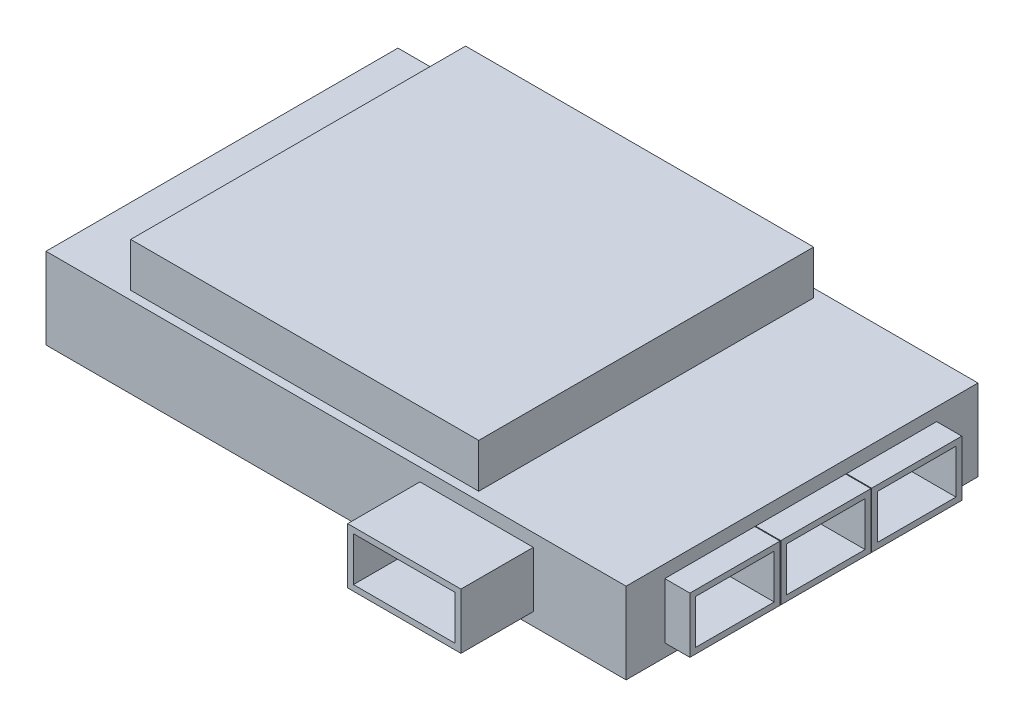
from build123d import *

# Parameters (mm, degrees)
SKETCH1_W           = 38.1
SKETCH1_H           = 23.114
BOSS_EXTRUDE1_DEPTH = 5.334
SKETCH2_W           = 22.86
SKETCH2_H           = 21.9964
BOSS_EXTRUDE2_DEPTH = 2.8956
SKETCH3_W           = 7.4422
SKETCH3_H           = 3.6576
BOSS_EXTRUDE3_DEPTH = 4.7498
SKETCH4_W           = 6.6802
SKETCH4_H           = 2.8956
CUT_EXTRUDE1_DEPTH  = 3.556
SKETCH5_W           = 5.9182
SKETCH5_H           = 3.6576
BOSS_EXTRUDE4_DEPTH = 1.651
SKETCH6_W           = 5.1562
SKETCH6_H           = 2.8956
CUT_EXTRUDE2_DEPTH  = 3.3782
LPATTERN1_COUNT     = 3
LPATTERN1_PITCH     = 5.969


with BuildPart() as part:
    # Sketch1 → Boss-Extrude1 (new body)
    with BuildSketch(Plane(origin=(0, 0, 0), x_dir=(1, 0, 0), z_dir=(0, 1, 0))):
        with Locations((19.05, 11.557)):
            Rectangle(SKETCH1_W, SKETCH1_H)
    extrude(amount=BOSS_EXTRUDE1_DEPTH)

    # Sketch2 → Boss-Extrude2 (add)
    with BuildSketch(Plane(origin=(0, 5.334, 0), x_dir=(1, 0, 0), z_dir=(0, 1, 0))):
        with Locations((16.4338, 11.557)):
            Rectangle(SKETCH2_W, SKETCH2_H)
    extrude(amount=BOSS_EXTRUDE2_DEPTH)

    # Sketch3 → Boss-Extrude3 (add)
    with BuildSketch(Plane.XY):
        with Locations((28.2829, 2.667)):
            Rectangle(SKETCH3_W, SKETCH3_H)
    extrude(amount=BOSS_EXTRUDE3_DEPTH)

    # Sketch4 → Cut-Extrude1 (cut)
    with BuildSketch(Plane.XY.offset(4.7498)):
        with Locations((28.2829, 2.667)):
            Rectangle(SKETCH4_W, SKETCH4_H)
    extrude(amount=-CUT_EXTRUDE1_DEPTH, mode=Mode.SUBTRACT)

    # Sketch5 → Boss-Extrude4 (add)
    with BuildSketch(Plane(origin=(38.1, 0, 0), x_dir=(0, 0, -1), z_dir=(1, 0, 0))):
        with Locations((5.4991, 2.667)):
            Rectangle(SKETCH5_W, SKETCH5_H)
    boss_extrude4 = extrude(amount=BOSS_EXTRUDE4_DEPTH)

    # Sketch6 → Cut-Extrude2 (cut)
    with BuildSketch(Plane(origin=(39.751, 0, 0), x_dir=(0, 0, -1), z_dir=(1, 0, 0))):
        with Locations((5.4991, 2.667)):
            Rectangle(SKETCH6_W, SKETCH6_H)
    cut_extrude2 = extrude(amount=-CUT_EXTRUDE2_DEPTH, mode=Mode.SUBTRACT)

    # LPattern1: Boss-Extrude4, Cut-Extrude2 ×3
    with Locations(*[(0, 0, -i * LPATTERN1_PITCH) for i in range(1, LPATTERN1_COUNT)]):
        add(boss_extrude4)
        add(cut_extrude2, mode=Mode.SUBTRACT)


solid = part.part
